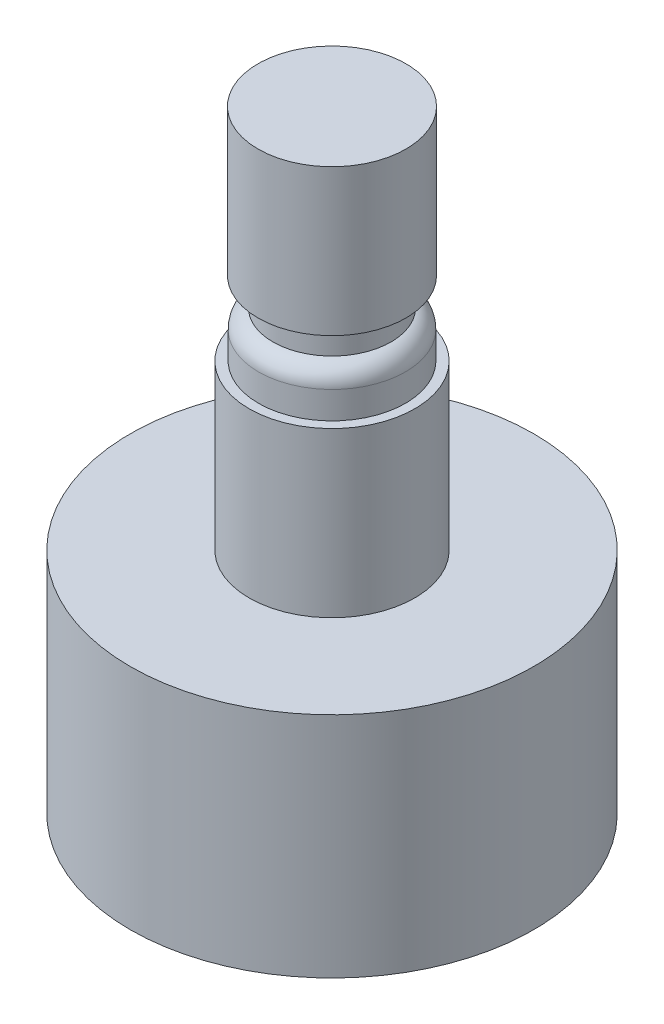
from build123d import *

# Parameters (mm, degrees)
SKETCH2_R           = 8.1915
BOSS_EXTRUDE1_DEPTH = 9.2583
SKETCH4_R           = 3.3655
BOSS_EXTRUDE3_DEPTH = 6.6548
SKETCH5_R           = 2.9845
BOSS_EXTRUDE4_DEPTH = 1.8669
FILLET1_R           = 0.762
SKETCH7_R           = 2.4003
BOSS_EXTRUDE5_DEPTH = 1.143
SKETCH8_R           = 3.00355
BOSS_EXTRUDE6_DEPTH = 5.9436


with BuildPart() as part:
    # Sketch2 → Boss-Extrude1 (new body)
    with BuildSketch(Plane(origin=(0, 0, 0), x_dir=(1, 0, 0), z_dir=(0, 1, 0))):
        with Locations(Location((0, 0, 0), (0, 0, 270))):
            Circle(SKETCH2_R)
    extrude(amount=BOSS_EXTRUDE1_DEPTH)

    # Sketch4 → Boss-Extrude3 (add)
    with BuildSketch(Plane(origin=(0, 9.2583, 0), x_dir=(1, 0, 0), z_dir=(0, 1, 0))):
        with Locations(Location((0, 0, 0), (0, 0, 270))):
            Circle(SKETCH4_R)
    extrude(amount=BOSS_EXTRUDE3_DEPTH)

    # Sketch5 → Boss-Extrude4 (add)
    with BuildSketch(Plane(origin=(0, 15.9131, 0), x_dir=(1, 0, 0), z_dir=(0, 1, 0))):
        with Locations(Location((0, 0, 0), (0, 0, 270))):
            Circle(SKETCH5_R)
    extrude(amount=BOSS_EXTRUDE4_DEPTH)

    # Fillet1
    fillet1_edges = [part.edges().sort_by_distance(p)[0] for p in [
        (0, 17.78, -2.9845),
    ]]
    fillet(fillet1_edges, radius=FILLET1_R)

    # Sketch7 → Boss-Extrude5 (add)
    with BuildSketch(Plane(origin=(0, 17.78, 0), x_dir=(1, 0, 0), z_dir=(0, 1, 0))):
        with Locations(Location((0, 0, 0), (0, 0, 270))):
            Circle(SKETCH7_R)
    extrude(amount=BOSS_EXTRUDE5_DEPTH)

    # Sketch8 → Boss-Extrude6 (add)
    with BuildSketch(Plane(origin=(0, 18.923, 0), x_dir=(1, 0, 0), z_dir=(0, 1, 0))):
        with Locations(Location((0, 0, 0), (0, 0, 270))):
            Circle(SKETCH8_R)
    extrude(amount=BOSS_EXTRUDE6_DEPTH)


solid = part.part
